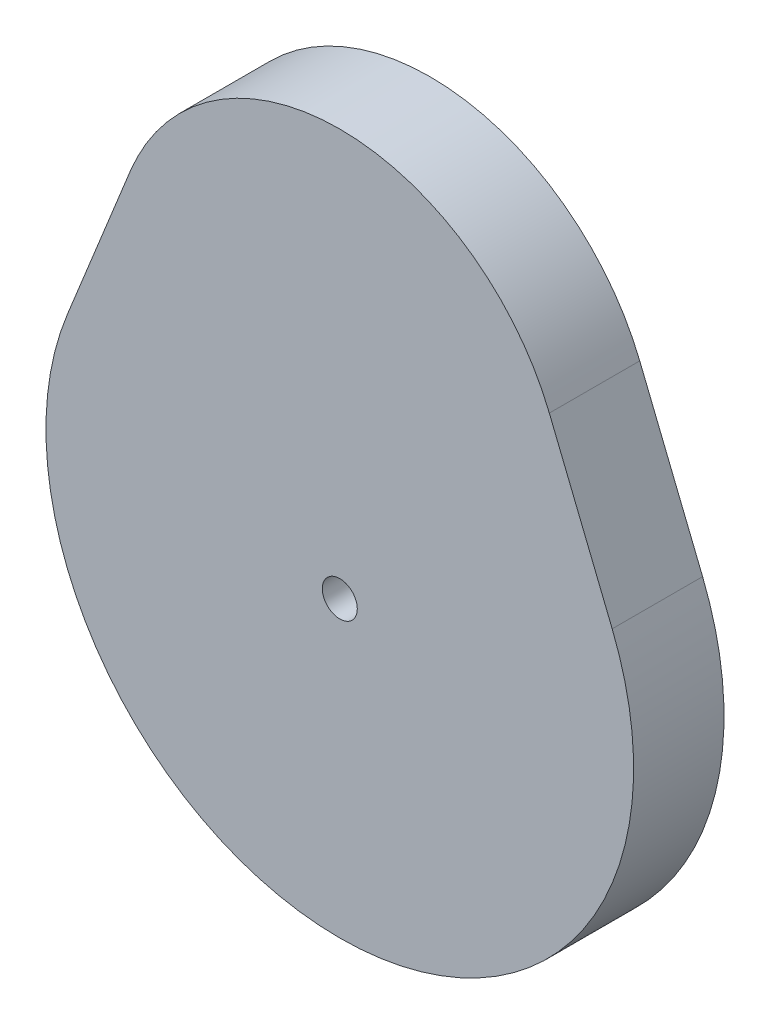
from build123d import *

# Parameters (mm, degrees)
BOSS_EXTRUDE1_DEPTH          = 12.7
F_10_0_1935_DIAMETER_HOLE1_D = 4.9149


with BuildPart() as part:
    # Sketch1 → Boss-Extrude1 (new body)
    with BuildSketch(Plane.XY):
        with BuildLine():
            ThreePointArc((-38.262949069, 15.478125), (0, -41.275), (38.262949069, 15.478125))
            Line((38.262949069, 15.478125), (29.433037746, 37.30625))
            ThreePointArc((29.433037746, 37.30625), (0, 57.15), (-29.433037746, 37.30625))
            Line((-29.433037746, 37.30625), (-38.262949069, 15.478125))
        make_face()
    extrude(amount=BOSS_EXTRUDE1_DEPTH)

    # #10 (0.1935) Diameter Hole1 (through all)
    with Locations(Plane.XY.offset(12.7)):
        with Locations((0, 0)):
            Hole(F_10_0_1935_DIAMETER_HOLE1_D / 2)


solid = part.part
